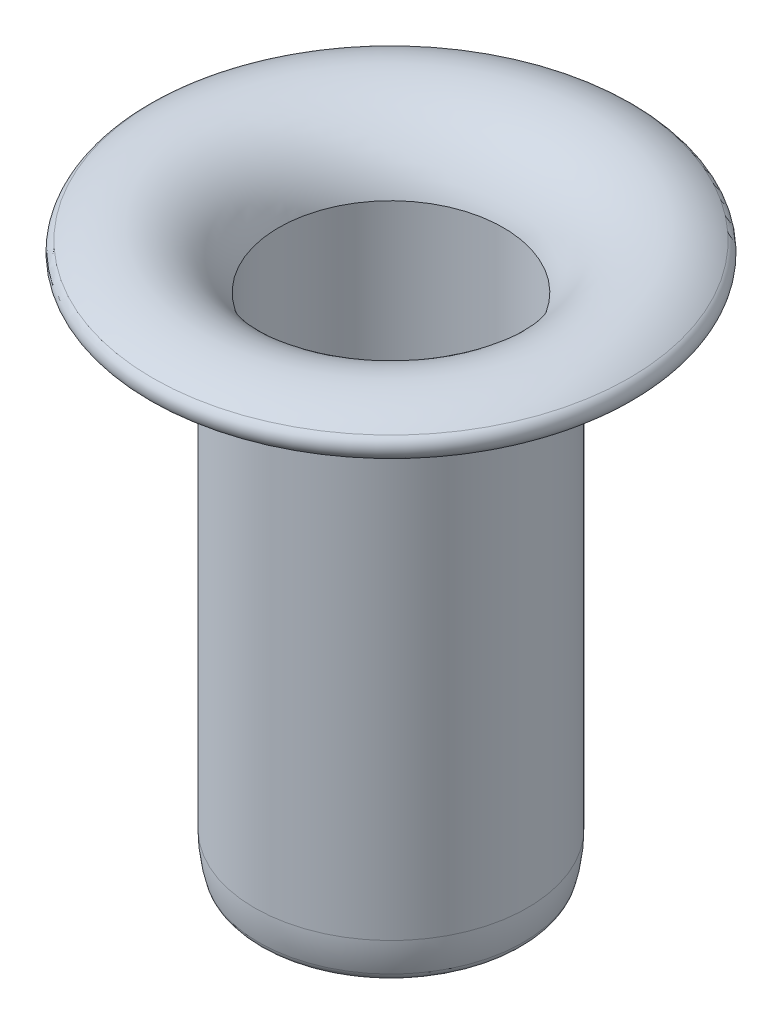
from build123d import *


with BuildPart() as part:
    # Sketch1 → Revolve1 (revolve)
    with BuildSketch(Plane(origin=(0, 0, 0), x_dir=(0, 0, -1), z_dir=(1, 0, 0)), mode=Mode.PRIVATE) as revolve1_sk:
        with BuildLine():
            Line((1.165, -0.479160352), (1.165, -5.3))
            ThreePointArc((1.165, -5.3), (1.156052459, -5.434806994), (1.129366812, -5.567248908))
            ThreePointArc((1.129366812, -5.567248908), (1.217248908, -5.720633188), (1.370633188, -5.632751092))
            ThreePointArc((1.370633188, -5.632751092), (1.403859434, -5.467847925), (1.415, -5.3))
            Line((1.415, -5.3), (1.415, -0.522708967))
            ThreePointArc((1.415, -0.522708967), (1.805935718, -0.155680528), (2.337866994, -0.223428063))
            ThreePointArc((2.337866994, -0.223428063), (2.510442683, -0.185118386), (2.472133006, -0.012542696))
            ThreePointArc((2.472133006, -0.012542696), (1.704447766, 0.073828552), (1.165, -0.479160352))
        make_face()
    revolve(revolve1_sk.sketch.rotate(Axis((0, 0, 0), (0, -1, 0)), 180), axis=Axis((0, 0, 0), (0, -1, 0)))


solid = part.part
